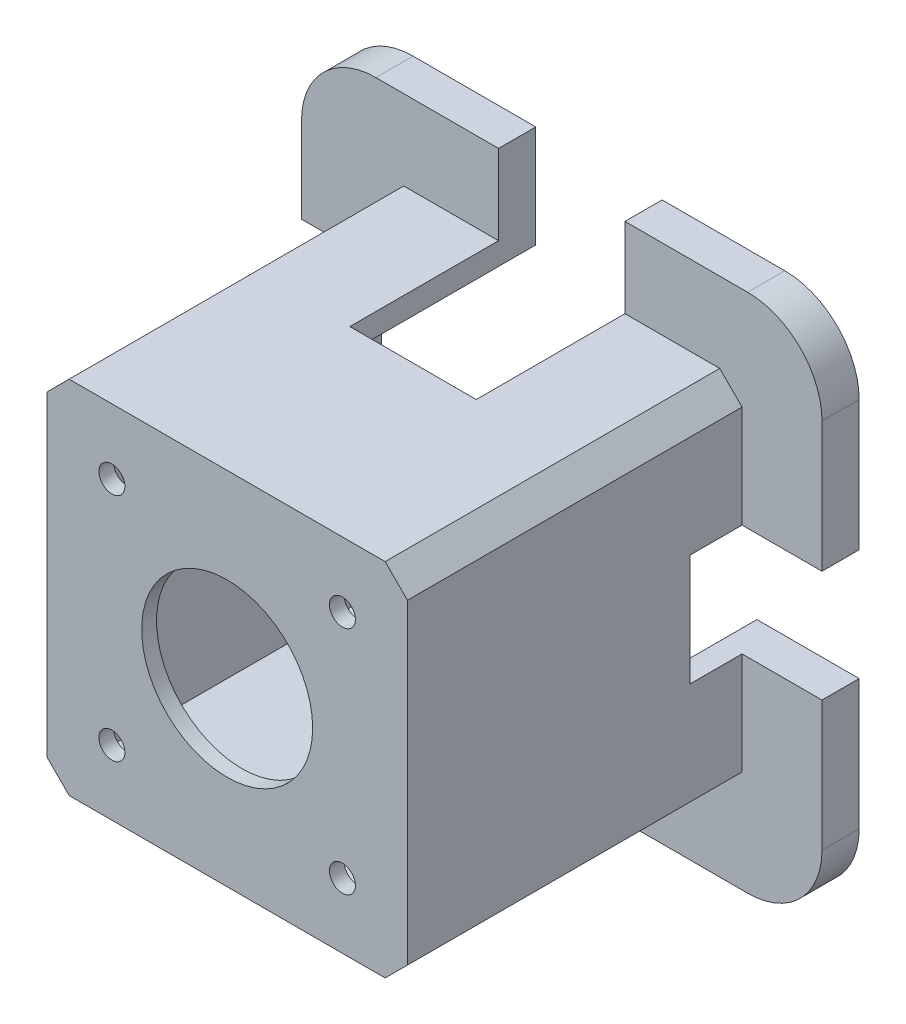
from build123d import *

# Parameters (mm, degrees)
SKETCH_1_W          = 42.5
SKETCH_1_H          = 42.5
SKETCH_1_R          = 1.75
EXTRUDE_1_DEPTH     = 2
SKETCH_2_W          = 48.5
SKETCH_2_H          = 48.5
SKETCH_2_W_2        = 42.5
SKETCH_2_H_2        = 42.5
EXTRUDE_2_DEPTH     = 50
CHAMFER_1_SIZE      = 3
SKETCH_3_W          = 70
SKETCH_3_H          = 70
SKETCH_3_W_2        = 42.5
SKETCH_3_H_2        = 42.5
EXTRUDE_2_2_DEPTH   = 5
FILLET_1_R          = 10
CUT_EXTRUDE_2_REACH = 93.81
SKETCH_5_W          = 17
SKETCH_5_H          = 33.225295521
CUT_EXTRUDE_3_REACH = 93.81
SKETCH_6_W          = 17.032391735
SKETCH_6_H          = 27
SKETCH_7_R          = 11.5
CUT_EXTRUDE_4_DEPTH = 10
CUT_EXTRUDE_5_REACH = 93.81
SKETCH_9_W          = 15
SKETCH_9_H          = 14
CUT_EXTRUDE_6_REACH = 93.81
SKETCH_10_W         = 19.722222222
SKETCH_10_H         = 15


with BuildPart() as part:
    # 草图1 → 凸台-拉伸1 (new body)
    with BuildSketch(Plane.XY):
        Rectangle(SKETCH_1_W, SKETCH_1_H)
        with Locations((15.5, 15.5)):
            Circle(SKETCH_1_R, mode=Mode.SUBTRACT)
        with Locations((15.5, -15.5)):
            Circle(SKETCH_1_R, mode=Mode.SUBTRACT)
        with Locations((-15.5, -15.5)):
            Circle(SKETCH_1_R, mode=Mode.SUBTRACT)
        with Locations((-15.5, 15.5)):
            Circle(SKETCH_1_R, mode=Mode.SUBTRACT)
    extrude(amount=EXTRUDE_1_DEPTH)

    # 草图2 → Extrude 2 (add)
    with BuildSketch(Plane.XY.offset(2)):
        Rectangle(SKETCH_2_W, SKETCH_2_H)
        Rectangle(SKETCH_2_W_2, SKETCH_2_H_2, mode=Mode.SUBTRACT)
    extrude(amount=-EXTRUDE_2_DEPTH)

    # 倒角1
    chamfer_1_edges = [part.edges().sort_by_distance(p)[0] for p in [
        (-24.25, -24.25, -23),
        (-24.25, 24.25, -23),
        (24.25, 24.25, -23),
        (24.25, -24.25, -23),
    ]]
    chamfer(chamfer_1_edges, length=CHAMFER_1_SIZE)

    # 草图3 → Extrude 2 2 (add)
    with BuildSketch(Plane(origin=(0, 0, -48), x_dir=(-1, 0, 0), z_dir=(0, 0, -1))):
        Rectangle(SKETCH_3_W, SKETCH_3_H)
        Rectangle(SKETCH_3_W_2, SKETCH_3_H_2, mode=Mode.SUBTRACT)
    extrude(amount=-EXTRUDE_2_2_DEPTH)

    # 圆角1
    fillet_1_edges = [part.edges().sort_by_distance(p)[0] for p in [
        (35, -35, -45.5),
        (35, 35, -45.5),
        (-35, 35, -45.5),
        (-35, -35, -45.5),
    ]]
    fillet(fillet_1_edges, radius=FILLET_1_R)

    # 切除-拉伸2: up to this face of the body (flat: up to its plane)
    cut_extrude_2_end = Plane(part.part.faces().sort_by_distance((0, 21.25, -24))[0])
    # 草图5 → 切除-拉伸2 (cut, up to the picked face)
    with BuildSketch(Plane(origin=(0, 35, 0), x_dir=(1, 0, 0), z_dir=(0, 1, 0)), mode=Mode.PRIVATE) as cut_extrude_2_sk1:
        with Locations((0, 39.612647761)):
            Rectangle(SKETCH_5_W, SKETCH_5_H)
    cut_extrude_2_tool1 = split(extrude(cut_extrude_2_sk1.sketch, amount=-CUT_EXTRUDE_2_REACH, mode=Mode.PRIVATE), bisect_by=cut_extrude_2_end, keep=Keep.BOTH, mode=Mode.PRIVATE)
    add(cut_extrude_2_tool1.solids().sort_by(Axis((0, 35, -39.612648), (0, -1, 0)))[0], mode=Mode.SUBTRACT)

    # 切除-拉伸3: up to this face of the body (flat: up to its plane)
    cut_extrude_3_end = Plane(part.part.faces().sort_by_distance((-21.25, 0, -24))[0])
    # 草图6 → 切除-拉伸3 (cut, up to the picked face)
    with BuildSketch(Plane.ZY.offset(35), mode=Mode.PRIVATE) as cut_extrude_3_sk1:
        with Locations((-48.516195868, 0)):
            Rectangle(SKETCH_6_W, SKETCH_6_H)
    cut_extrude_3_tool1 = split(extrude(cut_extrude_3_sk1.sketch, amount=-CUT_EXTRUDE_3_REACH, mode=Mode.PRIVATE), bisect_by=cut_extrude_3_end, keep=Keep.BOTH, mode=Mode.PRIVATE)
    add(cut_extrude_3_tool1.solids().sort_by(Axis((-35, 0, -48.516196), (1, 0, 0)))[0], mode=Mode.SUBTRACT)

    # 草图7 → 切除-拉伸4 (cut)
    with BuildSketch(Plane.XY.offset(2)):
        Circle(SKETCH_7_R)
    extrude(amount=-CUT_EXTRUDE_4_DEPTH, mode=Mode.SUBTRACT)

    # 草图9 → 切除-拉伸5 (cut, up to next)
    with BuildSketch(Plane.XZ.offset(35), mode=Mode.PRIVATE) as cut_extrude_5_sk1:
        with Locations((0, -43)):
            Rectangle(SKETCH_9_W, SKETCH_9_H)
    cut_extrude_5_tool1 = extrude(cut_extrude_5_sk1.sketch, amount=-CUT_EXTRUDE_5_REACH, mode=Mode.PRIVATE) & part.part
    add(cut_extrude_5_tool1.solids().sort_by_distance((0, -35, -43))[0], mode=Mode.SUBTRACT)

    # 草图10 → 切除-拉伸6 (cut, up to next)
    with BuildSketch(Plane(origin=(35, 0, 0), x_dir=(0, 0, -1), z_dir=(1, 0, 0)), mode=Mode.PRIVATE) as cut_extrude_6_sk1:
        with Locations((45.861111111, 0)):
            Rectangle(SKETCH_10_W, SKETCH_10_H)
    cut_extrude_6_tool1 = extrude(cut_extrude_6_sk1.sketch, amount=-CUT_EXTRUDE_6_REACH, mode=Mode.PRIVATE) & part.part
    add(cut_extrude_6_tool1.solids().sort_by_distance((35, 0, -45.861111))[0], mode=Mode.SUBTRACT)


solid = part.part
